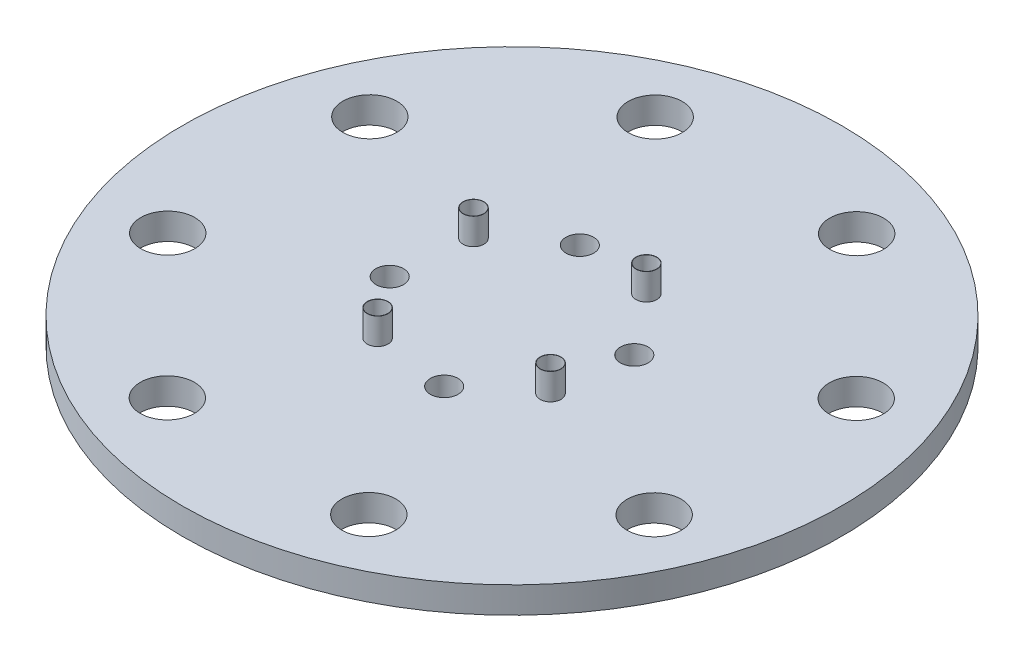
from build123d import *

# Parameters (mm, degrees)
SKETCH1_R           = 25
BOSS_EXTRUDE1_DEPTH = 2
SKETCH2_R           = 1.05
SKETCH2_R_2         = 0.79375
CUT_EXTRUDE1_DEPTH  = 36.411862419
SKETCH4_R           = 2.05
CUT_EXTRUDE3_DEPTH  = 36.411862419
BOSS_EXTRUDE2_START = 4
SKETCH7_R           = 0.79375
SKETCH7_R_2         = 0.77375
BOSS_EXTRUDE2_DEPTH = 4


with BuildPart() as part:
    # Sketch1 → Boss-Extrude1 (new body)
    with BuildSketch(Plane(origin=(0, 0, 0), x_dir=(1, 0, 0), z_dir=(0, 1, 0))):
        with Locations(Location((0, 0, 0), (0, 0, 270))):
            Circle(SKETCH1_R)
    extrude(amount=BOSS_EXTRUDE1_DEPTH)

    # Sketch2 → Cut-Extrude1 (cut, through all)
    with BuildSketch(Plane(origin=(0, 2, 0), x_dir=(1, 0, 0), z_dir=(0, 1, 0))):
        with Locations(Location((-2.066368974, 7.209723938, 0), (0, 0, 270))):
            Circle(SKETCH2_R)
        with Locations(Location((7.209723938, 2.066368974, 0), (0, 0, 270))):
            Circle(SKETCH2_R)
        with Locations(Location((2.066368974, -7.209723938, 0), (0, 0, 270))):
            Circle(SKETCH2_R)
        with Locations(Location((-7.209723938, -2.066368974, 0), (0, 0, 270))):
            Circle(SKETCH2_R)
        with Locations(Location((-3.636901173, -6.559188201, 0), (0, 0, 270))):
            Circle(SKETCH2_R_2)
        with Locations(Location((-6.559188201, 3.636901173, 0), (0, 0, 270))):
            Circle(SKETCH2_R_2)
        with Locations(Location((3.636901173, 6.559188201, 0), (0, 0, 270))):
            Circle(SKETCH2_R_2)
        with Locations(Location((6.559188201, -3.636901173, 0), (0, 0, 270))):
            Circle(SKETCH2_R_2)
    extrude(amount=-CUT_EXTRUDE1_DEPTH, mode=Mode.SUBTRACT)

    # Sketch4 → Cut-Extrude3 (cut, through all)
    with BuildSketch(Plane.XZ):
        with Locations(Location((-18.488747294, 7.626678405, 0), (0, 0, 270))):
            Circle(SKETCH4_R)
        with Locations(Location((-7.680642569, 18.466394605, 0), (0, 0, 270))):
            Circle(SKETCH4_R)
        with Locations(Location((7.626678405, 18.488747294, 0), (0, 0, 270))):
            Circle(SKETCH4_R)
        with Locations(Location((18.466394605, 7.680642569, 0), (0, 0, 270))):
            Circle(SKETCH4_R)
        with Locations(Location((18.488747294, -7.626678405, 0), (0, 0, 270))):
            Circle(SKETCH4_R)
        with Locations(Location((7.680642569, -18.466394605, 0), (0, 0, 270))):
            Circle(SKETCH4_R)
        with Locations(Location((-7.626678405, -18.488747294, 0), (0, 0, 270))):
            Circle(SKETCH4_R)
        with Locations(Location((-18.466394605, -7.680642569, 0), (0, 0, 270))):
            Circle(SKETCH4_R)
    extrude(amount=-CUT_EXTRUDE3_DEPTH, mode=Mode.SUBTRACT)

    # Sketch7 → Boss-Extrude2 (add)
    # profile 1 of 4: a face of its own
    with BuildSketch(Plane(origin=(0, 0, 0), x_dir=(1, 0, 0), z_dir=(0, 1, 0)).offset(BOSS_EXTRUDE2_START)):
        with Locations(Location((-3.636901173, -6.559188201, 0), (0, 0, 270))):
            Circle(SKETCH7_R)
        with Locations(Location((-3.636901173, -6.559188201, 0), (0, 0, 270))):
            Circle(SKETCH7_R_2, mode=Mode.SUBTRACT)
    # profile 2 of 4: a face of its own
    with BuildSketch(Plane(origin=(0, 0, 0), x_dir=(1, 0, 0), z_dir=(0, 1, 0)).offset(BOSS_EXTRUDE2_START)):
        with Locations(Location((6.559188201, -3.636901173, 0), (0, 0, 270))):
            Circle(SKETCH7_R)
        with Locations(Location((6.559188201, -3.636901173, 0), (0, 0, 270))):
            Circle(SKETCH7_R_2, mode=Mode.SUBTRACT)
    # profile 3 of 4: a face of its own
    with BuildSketch(Plane(origin=(0, 0, 0), x_dir=(1, 0, 0), z_dir=(0, 1, 0)).offset(BOSS_EXTRUDE2_START)):
        with Locations(Location((-6.559188201, 3.636901173, 0), (0, 0, 270))):
            Circle(SKETCH7_R)
        with Locations(Location((-6.559188201, 3.636901173, 0), (0, 0, 270))):
            Circle(SKETCH7_R_2, mode=Mode.SUBTRACT)
    # profile 4 of 4: a face of its own
    with BuildSketch(Plane(origin=(0, 0, 0), x_dir=(1, 0, 0), z_dir=(0, 1, 0)).offset(BOSS_EXTRUDE2_START)):
        with Locations(Location((3.636901173, 6.559188201, 0), (0, 0, 270))):
            Circle(SKETCH7_R)
        with Locations(Location((3.636901173, 6.559188201, 0), (0, 0, 270))):
            Circle(SKETCH7_R_2, mode=Mode.SUBTRACT)
    extrude(amount=-BOSS_EXTRUDE2_DEPTH)


solid = part.part
